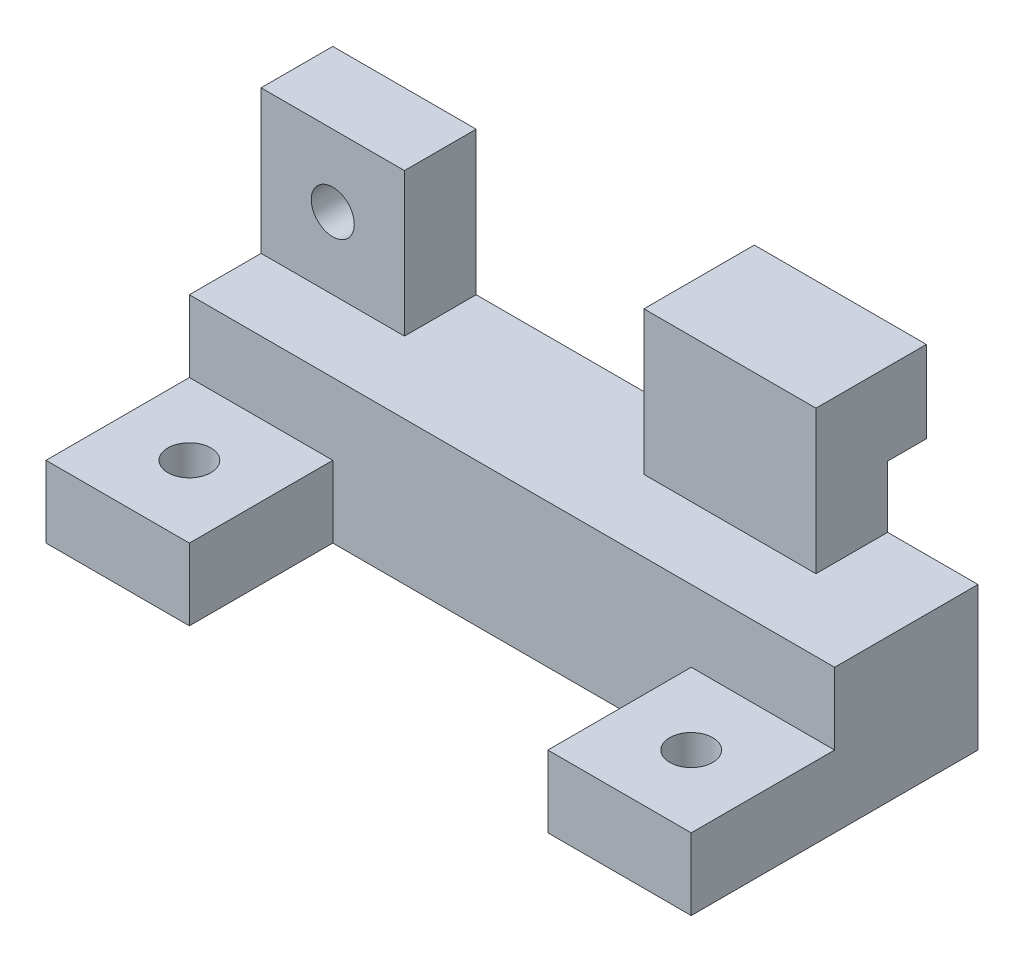
from build123d import *

# Parameters (mm, degrees)
SKETCH1_W           = 45
SKETCH1_H           = 10
BOSS_EXTRUDE1_DEPTH = 10
SKETCH2_W           = 10
SKETCH2_H           = 5
SKETCH2_W_2         = 12
BOSS_EXTRUDE2_DEPTH = 10
SKETCH3_W           = 10
SKETCH3_H           = 5
BOSS_EXTRUDE3_DEPTH = 10
SKETCH4_R           = 1.5
CUT_EXTRUDE1_DEPTH  = 5
SKETCH9_R           = 1.5
CUT_EXTRUDE6_DEPTH  = 5
SKETCH10_R          = 1.5
CUT_EXTRUDE7_DEPTH  = 5
SKETCH11_W          = 12
SKETCH11_H          = 5.7
BOSS_EXTRUDE4_DEPTH = 2.7
SKETCH7_W           = 10
SKETCH7_H           = 10
BOSS_EXTRUDE5_DEPTH = 35
SKETCH13_W          = 12
SKETCH13_H          = 5
BOSS_EXTRUDE6_DEPTH = 10
SKETCH14_W          = 12
SKETCH14_H          = 5.7
BOSS_EXTRUDE7_DEPTH = 2.7
SKETCH15_W          = 5
SKETCH15_H          = 10
CUT_EXTRUDE9_DEPTH  = 50
SKETCH16_W          = 10
SKETCH16_H          = 5
BOSS_EXTRUDE8_DEPTH = 10
SKETCH17_R          = 1.5
CUT_EXTRUDE10_DEPTH = 5


with BuildPart() as part:
    # Sketch1 → Boss-Extrude1 (new body)
    with BuildSketch(Plane.XY):
        with Locations((22.5, 5)):
            Rectangle(SKETCH1_W, SKETCH1_H)
    extrude(amount=BOSS_EXTRUDE1_DEPTH)

    # Sketch2 → Boss-Extrude2 (add)
    with BuildSketch(Plane(origin=(0, 10, 0), x_dir=(1, 0, 0), z_dir=(0, 1, 0))):
        with Locations((40, -2.5)):
            Rectangle(SKETCH2_W, SKETCH2_H)
        with Locations((12.3, -2.5)):
            Rectangle(SKETCH2_W_2, SKETCH2_H)
    extrude(amount=BOSS_EXTRUDE2_DEPTH)

    # Sketch3 → Boss-Extrude3 (add)
    with BuildSketch(Plane.XY.offset(10)):
        with Locations((5, 2.5)):
            Rectangle(SKETCH3_W, SKETCH3_H)
        with Locations((40, 2.5)):
            Rectangle(SKETCH3_W, SKETCH3_H)
    extrude(amount=BOSS_EXTRUDE3_DEPTH)

    # Sketch4 → Cut-Extrude1 (cut)
    with BuildSketch(Plane.ZY):
        with Locations((5, 5)):
            Circle(SKETCH4_R)
    extrude(amount=-CUT_EXTRUDE1_DEPTH, mode=Mode.SUBTRACT)

    # Sketch9 → Cut-Extrude6 (cut)
    with BuildSketch(Plane(origin=(0, 5, 0), x_dir=(1, 0, 0), z_dir=(0, 1, 0))):
        with Locations(Location((40, -15, 0), (0, 0, 180))):
            Circle(SKETCH9_R)
    extrude(amount=-CUT_EXTRUDE6_DEPTH, mode=Mode.SUBTRACT)

    # Sketch10 → Cut-Extrude7 (cut)
    with BuildSketch(Plane.XY.offset(5)):
        with Locations((40, 15)):
            Circle(SKETCH10_R)
    extrude(amount=-CUT_EXTRUDE7_DEPTH, mode=Mode.SUBTRACT)

    # Sketch11 → Boss-Extrude4 (add)
    with BuildSketch(Plane(origin=(0, 0, 0), x_dir=(-1, 0, 0), z_dir=(0, 0, -1))):
        with Locations((-12.3, 17.15)):
            Rectangle(SKETCH11_W, SKETCH11_H)
    extrude(amount=BOSS_EXTRUDE4_DEPTH)

    # Sketch7 → Boss-Extrude5 (add)
    with BuildSketch(Plane(origin=(45, 0, 0), x_dir=(0, 0, -1), z_dir=(1, 0, 0))):
        with Locations((-5, 5)):
            Rectangle(SKETCH7_W, SKETCH7_H)
    extrude(amount=BOSS_EXTRUDE5_DEPTH)

    # Sketch13 → Boss-Extrude6 (add)
    with BuildSketch(Plane(origin=(0, 10, 0), x_dir=(1, 0, 0), z_dir=(0, 1, 0))):
        with Locations((67.7, -2.5)):
            Rectangle(SKETCH13_W, SKETCH13_H)
    extrude(amount=BOSS_EXTRUDE6_DEPTH)

    # Sketch14 → Boss-Extrude7 (add)
    with BuildSketch(Plane(origin=(0, 0, 0), x_dir=(-1, 0, 0), z_dir=(0, 0, -1))):
        with Locations((-67.7, 17.15)):
            Rectangle(SKETCH14_W, SKETCH14_H)
    extrude(amount=BOSS_EXTRUDE7_DEPTH)

    # Sketch15 → Cut-Extrude9 (cut)
    with BuildSketch(Plane.ZY.offset(-35)):
        Polygon((20, 20), (5, 20), (5, 10), (0, 10), (0, 0), (20, 0), align=None)
        with Locations((2.5, 15)):
            Rectangle(SKETCH15_W, SKETCH15_H)
        Polygon((0, 10), (0, 20), (-5, 20), (-5, 0), (0, 0), align=None)
    extrude(amount=CUT_EXTRUDE9_DEPTH, mode=Mode.SUBTRACT)

    # Sketch16 → Boss-Extrude8 (add)
    with BuildSketch(Plane.XY.offset(10)):
        with Locations((75, 2.5)):
            Rectangle(SKETCH16_W, SKETCH16_H)
    extrude(amount=BOSS_EXTRUDE8_DEPTH)

    # Sketch17 → Cut-Extrude10 (cut)
    with BuildSketch(Plane(origin=(0, 5, 0), x_dir=(1, 0, 0), z_dir=(0, 1, 0))):
        with Locations(Location((75, -15, 0), (0, 0, 180))):
            Circle(SKETCH17_R)
    extrude(amount=-CUT_EXTRUDE10_DEPTH, mode=Mode.SUBTRACT)


solid = part.part
